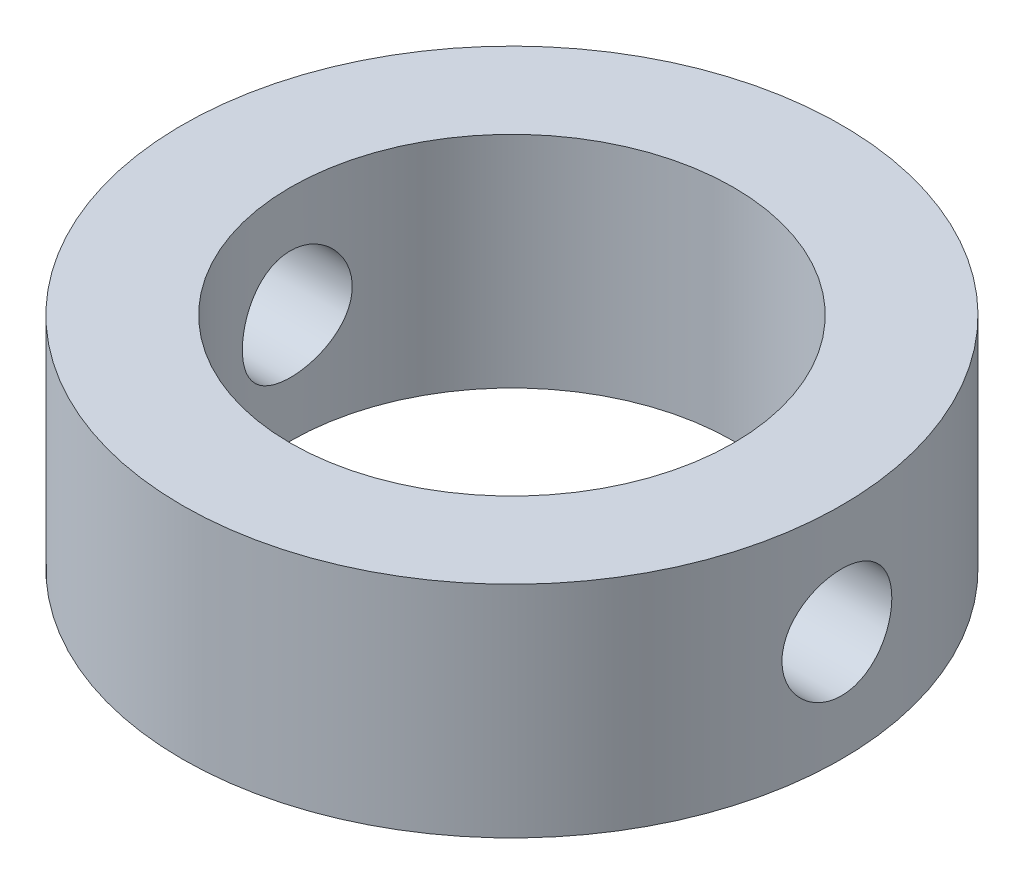
from build123d import *

# Parameters (mm, degrees)
COLLAR_STOCK_SKETCH_R             = 9
COLLAR_STOCK_DEPTH                = 6
AXLE_COLLAR_BORE_SKETCH_R         = 6.05
AXLE_COLLAR_BORE_DEPTH            = 6.2
POSITIVE_SPRING_PIN_BORE_SKETCH_R = 1.5
POSITIVE_SPRING_PIN_BORE_DEPTH    = 20


with BuildPart() as part:
    # Collar stock sketch → Collar stock (new body)
    with BuildSketch(Plane(origin=(0, -246.5, 0), x_dir=(1, 0, 0), z_dir=(0, 1, 0))):
        with Locations(Location((-19.009182883, 53.244882879, 0), (0, 0, 270))):
            Circle(COLLAR_STOCK_SKETCH_R)
    extrude(amount=COLLAR_STOCK_DEPTH)

    # Axle collar bore sketch → Axle collar bore (cut)
    with BuildSketch(Plane(origin=(0, -246.6, 0), x_dir=(1, 0, 0), z_dir=(0, 1, 0))):
        with Locations(Location((-19.009182883, 53.244882879, 0), (0, 0, 270))):
            Circle(AXLE_COLLAR_BORE_SKETCH_R)
    extrude(amount=AXLE_COLLAR_BORE_DEPTH, mode=Mode.SUBTRACT)

    # Positive spring pin bore sketch → Positive spring pin bore (cut)
    with BuildSketch(Plane(origin=(-29.009182883, 0, 0), x_dir=(0, 0, -1), z_dir=(1, 0, 0))):
        with Locations(Location((53.244882879, -243.5, 0), (0, 0, 180))):
            Circle(POSITIVE_SPRING_PIN_BORE_SKETCH_R)
    extrude(amount=POSITIVE_SPRING_PIN_BORE_DEPTH, mode=Mode.SUBTRACT)


solid = part.part
